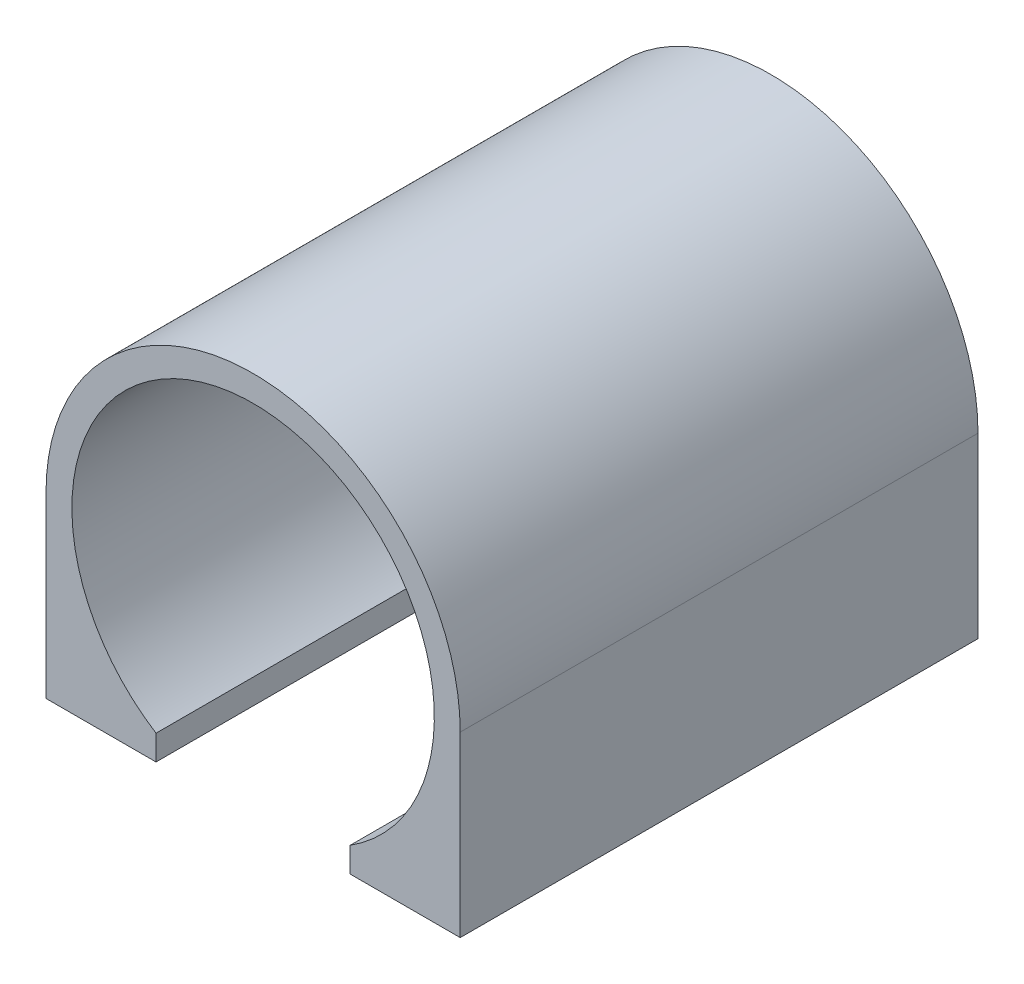
from build123d import *

# Parameters (mm, degrees)
BOSS_EXTRUDE1_DEPTH     = 40
SKETCH2_R               = 1.5
CUT_EXTRUDE1_DEPTH      = 3
SKETCH3_W               = 15
SKETCH3_H               = 10
CUT_EXTRUDE_THIN1_DEPTH = 46.956501172


with BuildPart() as part:
    # Sketch1 → Boss-Extrude1 (new body)
    with BuildSketch(Plane.XY):
        with BuildLine():
            Line((-2.633913438, -13.75), (-16, -13.75))
            Line((-16, -13.75), (-16, 0))
            ThreePointArc((-16, 0), (0, 16), (16, 0))
            Line((16, 0), (16, -13.75))
            Line((16, -13.75), (2.633913438, -13.75))
            ThreePointArc((2.633913438, -13.75), (0, 14), (-2.633913438, -13.75))
        make_face()
    extrude(amount=BOSS_EXTRUDE1_DEPTH)

    # Sketch2 → Cut-Extrude1 (cut)
    with BuildSketch(Plane.XZ.offset(13.75)):
        with Locations((13, 33.333333333)):
            Circle(SKETCH2_R)
        with Locations((13, 20)):
            Circle(SKETCH2_R)
        with Locations((13, 6.666666667)):
            Circle(SKETCH2_R)
        with Locations(Location((-13, 6.666666667, 0), (0, 0, 180))):
            Circle(SKETCH2_R)
        with Locations(Location((-13, 20, 0), (0, 0, 180))):
            Circle(SKETCH2_R)
        with Locations(Location((-13, 33.333333333, 0), (0, 0, 180))):
            Circle(SKETCH2_R)
    extrude(amount=-CUT_EXTRUDE1_DEPTH, mode=Mode.SUBTRACT)

    # Sketch3 → Cut-Extrude-Thin1 (cut, through all)
    with BuildSketch(Plane.XY.offset(40)):
        with Locations((0, -8.75)):
            Rectangle(SKETCH3_W, SKETCH3_H)
    extrude(amount=-CUT_EXTRUDE_THIN1_DEPTH, mode=Mode.SUBTRACT)


solid = part.part
